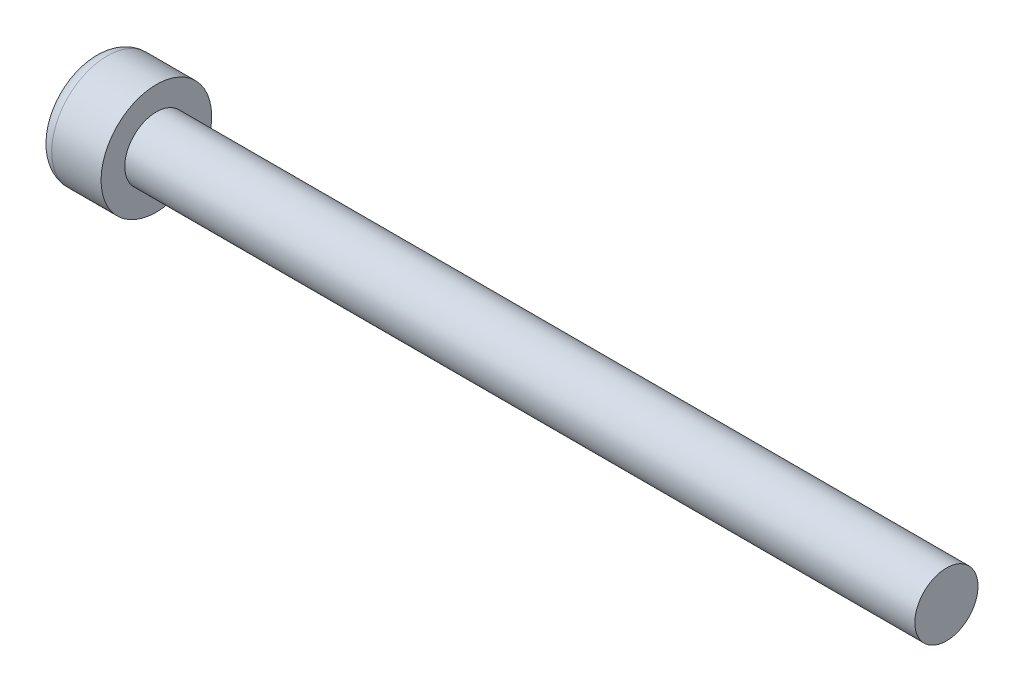
from build123d import *

# Parameters (mm, degrees)
CUT_EXTRUDE1_DEPTH = 2


with BuildPart() as part:
    # Sketch1 → Revolve1 (revolve)
    with BuildSketch(Plane.XY, mode=Mode.PRIVATE) as revolve1_sk:
        with BuildLine():
            Line((0, 0), (0, 2.625))
            ThreePointArc((0, 2.625), (0.256281566, 3.243718434), (0.875, 3.5))
            Line((0.875, 3.5), (4, 3.5))
            Line((4, 3.5), (4, 2))
            Line((4, 2), (54, 2))
            Line((54, 2), (54, 0))
            Line((54, 0), (0, 0))
        make_face()
    revolve(revolve1_sk.sketch.rotate(Axis((0, 0, 0), (1, 0, 0)), 180), axis=Axis((0, 0, 0), (1, 0, 0)))

    # Sketch2 → Cut-Extrude1 (cut)
    with BuildSketch(Plane.ZY):
        Polygon((0, 1.732050808), (-1.5, 0.866025404), (-1.5, -0.866025404), (0, -1.732050808), (1.5, -0.866025404), (1.5, 0.866025404), align=None)
    extrude(amount=-CUT_EXTRUDE1_DEPTH, mode=Mode.SUBTRACT)


solid = part.part
